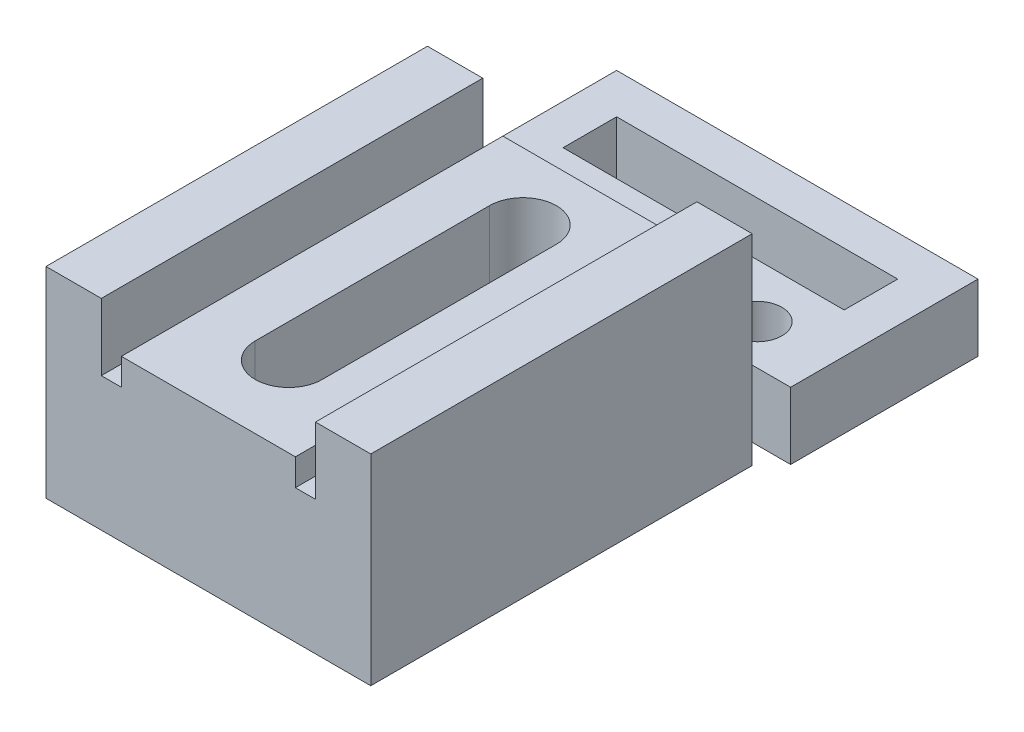
from build123d import *

# Parameters (mm, degrees)
CROQUIS1_W                    = 30
CROQUIS1_H                    = 10
SALIENTE_EXTRUIR1_DEPTH       = 18
CROQUIS2_W                    = 16
CROQUIS2_H                    = 3
CORTAR_EXTRUIR1_DEPTH         = 39.831471343
DI_METRO_DE_TALADRO_5_0_5_1_D = 5
DI_METRO_DE_TALADRO_5_0_5_2_D = 5
SALIENTE_EXTRUIR2_START       = 5
CROQUIS7_W                    = 18
CROQUIS7_H                    = 30
CROQUIS7_R                    = 2.5
CROQUIS7_R_2                  = 1.85
SALIENTE_EXTRUIR2_DEPTH       = 5
CORTAR_EXTRUIR3_REACH         = 99.487
CROQUIS9_W                    = 21
CROQUIS9_H                    = 4
CORTAR_EXTRUIR4_REACH         = 98.671
CROQUIS12_W                   = 1.5
CROQUIS12_H                   = 10
CROQUIS11_W                   = 3.131833875
CROQUIS11_H                   = 28.5
SALIENTE_EXTRUIR4_DEPTH       = 15
CROQUIS13_W                   = 1.5
CROQUIS13_H                   = 28.5
CORTAR_EXTRUIR5_DEPTH         = 2
CORTAR_EXTRUIR6_START         = -12
CORTAR_EXTRUIR6_DEPTH         = 15


with BuildPart() as part:
    # Croquis1 → Saliente-Extruir1 (new body)
    with BuildSketch(Plane(origin=(0, 0, 0), x_dir=(0, 0, -1), z_dir=(1, 0, 0))):
        with Locations((64.661633078, 1.848832797)):
            Rectangle(CROQUIS1_W, CROQUIS1_H)
    extrude(amount=-SALIENTE_EXTRUIR1_DEPTH)

    # Croquis2 → Cortar-Extruir1 (cut, through all)
    with BuildSketch(Plane(origin=(0, 13.697665595, -49.661633078), x_dir=(1, 0, 0), z_dir=(0, 0, -1))):
        with Locations((-9, 8.348832797)):
            Rectangle(CROQUIS2_W, CROQUIS2_H)
    extrude(amount=CORTAR_EXTRUIR1_DEPTH, mode=Mode.SUBTRACT)

    # Diámetro de taladro Ø5.0 (5)1 (through all)
    with Locations(Plane(origin=(0, 3.848832797, 0), x_dir=(1, 0, 0), z_dir=(0, 1, 0))):
        with Locations((-9, 65.161633078)):
            Hole(DI_METRO_DE_TALADRO_5_0_5_1_D / 2)

    # Diámetro de taladro Ø5.0 (5)2 (through all)
    with Locations(Plane(origin=(0, 3.848832797, 0), x_dir=(1, 0, 0), z_dir=(0, 1, 0))):
        with Locations((-9, 73.161633078)):
            Hole(DI_METRO_DE_TALADRO_5_0_5_2_D / 2)

    # Croquis7 → Saliente-Extruir2 (add)
    # profile 1 of 2: a face of its own
    with BuildSketch(Plane.XZ.offset(3.151167203).offset(SALIENTE_EXTRUIR2_START)):
        with Locations((-9, -64.661633078)):
            Rectangle(CROQUIS7_W, CROQUIS7_H)
        with Locations(Location((-9, -65.161633078, 0), (0, 0, 90))):
            Circle(CROQUIS7_R, mode=Mode.SUBTRACT)
        with Locations(Location((-9, -73.161633078, 0), (0, 0, 90))):
            Circle(CROQUIS7_R, mode=Mode.SUBTRACT)
    # profile 2 of 2: a face of its own
    with BuildSketch(Plane.XZ.offset(3.151167203).offset(SALIENTE_EXTRUIR2_START)):
        Polygon((0, -79.661633078), (4.5, -79.661633078), (4.5, -93.661633078), (-22.5, -93.661633078), (-22.5, -79.661633078), (-18, -79.661633078), align=None)
        with Locations(Location((-17, -82.661633078, 0), (0, 0, 270))):
            Circle(CROQUIS7_R_2, mode=Mode.SUBTRACT)
        with Locations(Location((-1, -82.661633078, 0), (0, 0, 270))):
            Circle(CROQUIS7_R_2, mode=Mode.SUBTRACT)
    extrude(amount=-SALIENTE_EXTRUIR2_DEPTH)

    # Croquis9 → Cortar-Extruir3 (cut, up to next)
    with BuildSketch(Plane(origin=(0, -8.151167203, 0), x_dir=(-1, 0, 0), z_dir=(0, -1, 0)), mode=Mode.PRIVATE) as cortar_extruir3_sk1:
        with Locations((9, 88.661633078)):
            Rectangle(CROQUIS9_W, CROQUIS9_H)
    cortar_extruir3_tool1 = extrude(cortar_extruir3_sk1.sketch, amount=-CORTAR_EXTRUIR3_REACH, mode=Mode.PRIVATE) & part.part
    add(cortar_extruir3_tool1.solids().sort_by_distance((-9, -8.151167, -88.661633))[0], mode=Mode.SUBTRACT)

    # Croquis12 → Cortar-Extruir4 (cut, up to next)
    with BuildSketch(Plane.ZY.offset(18), mode=Mode.PRIVATE) as cortar_extruir4_sk1:
        with Locations((-78.911633078, 1.848832797)):
            Rectangle(CROQUIS12_W, CROQUIS12_H)
    cortar_extruir4_tool1 = extrude(cortar_extruir4_sk1.sketch, amount=-CORTAR_EXTRUIR4_REACH, mode=Mode.PRIVATE) & part.part
    add(cortar_extruir4_tool1.solids().sort_by_distance((-18, 1.848833, -78.911633))[0], mode=Mode.SUBTRACT)

    # Croquis11 → Saliente-Extruir4 (add)
    with BuildSketch(Plane(origin=(0, 6.848832797, 0), x_dir=(1, 0, 0), z_dir=(0, 1, 0))):
        with Locations((-19.565916937, 63.911633078)):
            Rectangle(CROQUIS11_W, CROQUIS11_H)
        with Locations((1.565916938, 63.911633078)):
            Rectangle(CROQUIS11_W, CROQUIS11_H)
    extrude(amount=-SALIENTE_EXTRUIR4_DEPTH)

    # Croquis13 → Cortar-Extruir5 (cut)
    with BuildSketch(Plane(origin=(0, 3.848832797, 0), x_dir=(1, 0, 0), z_dir=(0, 1, 0))):
        with Locations((-16.25, 63.911633078)):
            Rectangle(CROQUIS13_W, CROQUIS13_H)
        with Locations((-1.75, 63.911633078)):
            Rectangle(CROQUIS13_W, CROQUIS13_H)
    extrude(amount=-CORTAR_EXTRUIR5_DEPTH, mode=Mode.SUBTRACT)

    # Croquis14 → Cortar-Extruir6 (cut)
    with BuildSketch(Plane(origin=(0, 3.848832797, 0), x_dir=(1, 0, 0), z_dir=(0, 1, 0)).offset(CORTAR_EXTRUIR6_START)):
        with BuildLine():
            Line((-6.5, 55.661633078), (-6.5, 73.161633078))
            ThreePointArc((-6.5, 73.161633078), (-9, 75.661633078), (-11.5, 73.161633078))
            Line((-11.5, 73.161633078), (-11.5, 55.661633078))
            ThreePointArc((-11.5, 55.661633078), (-9, 53.161633078), (-6.5, 55.661633078))
        make_face()
    extrude(amount=CORTAR_EXTRUIR6_DEPTH, mode=Mode.SUBTRACT)


solid = part.part
